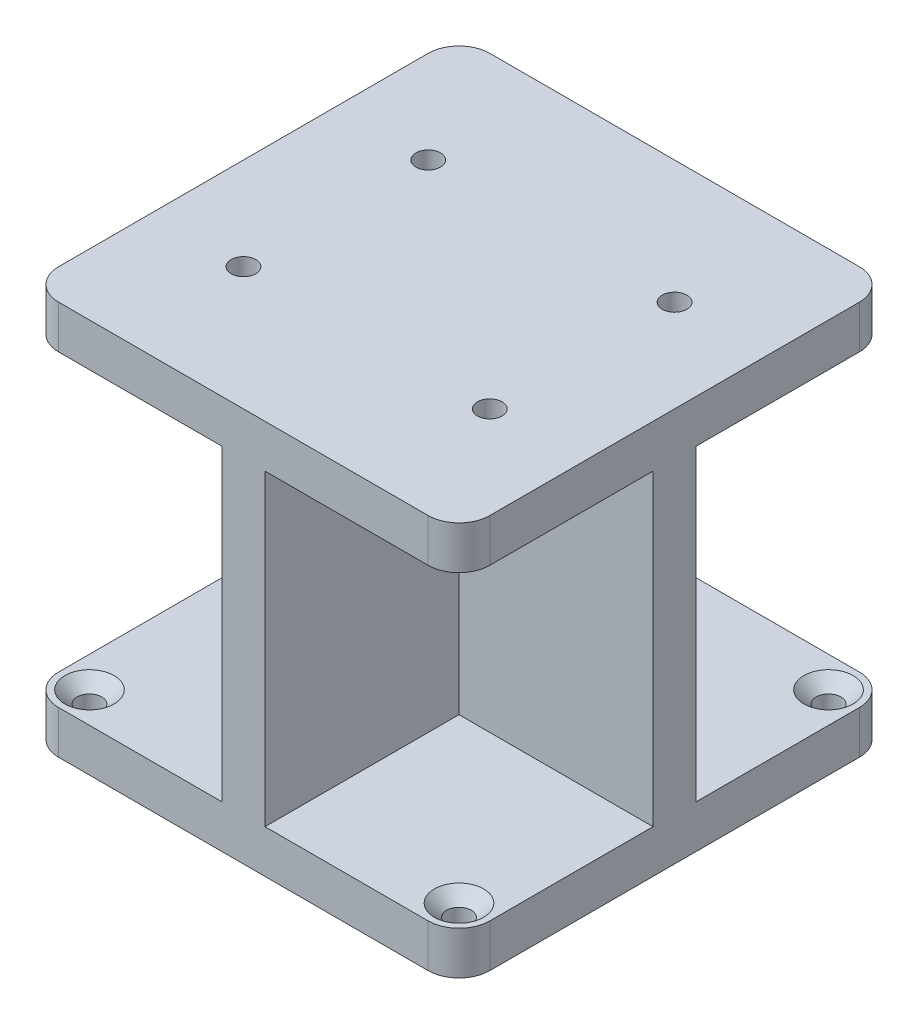
from build123d import *

# Parameters (mm, degrees)
SKETCH1_R           = 2
BOSS_EXTRUDE1_DEPTH = 3.5
BOSS_EXTRUDE2_DEPTH = 50
BOSS_EXTRUDE3_START = 7
SKETCH3_R           = 2
BOSS_EXTRUDE3_DEPTH = 7
CHAMFER1_SIZE       = 2


with BuildPart() as part:
    # Sketch1 → Boss-Extrude1 (new, symmetric)
    with BuildSketch(Plane(origin=(0, 0, 0), x_dir=(1, 0, 0), z_dir=(0, 1, 0))):
        with BuildLine():
            Line((-30, 35), (30, 35))
            ThreePointArc((30, 35), (33.535533906, 33.535533906), (35, 30))
            Line((35, 30), (35, -30))
            ThreePointArc((35, -30), (33.535533906, -33.535533906), (30, -35))
            Line((30, -35), (-30, -35))
            ThreePointArc((-30, -35), (-33.535533906, -33.535533906), (-35, -30))
            Line((-35, -30), (-35, 30))
            ThreePointArc((-35, 30), (-33.535533906, 33.535533906), (-30, 35))
        make_face()
        with Locations(Location((30, 30, 0), (0, 0, 270))):
            Circle(SKETCH1_R, mode=Mode.SUBTRACT)
        with Locations(Location((-30, 30, 0), (0, 0, 90))):
            Circle(SKETCH1_R, mode=Mode.SUBTRACT)
        with Locations(Location((30, -30, 0), (0, 0, 90))):
            Circle(SKETCH1_R, mode=Mode.SUBTRACT)
        with Locations(Location((-30, -30, 0), (0, 0, 270))):
            Circle(SKETCH1_R, mode=Mode.SUBTRACT)
    extrude(amount=BOSS_EXTRUDE1_DEPTH, both=True)

    # Sketch2 → Boss-Extrude2 (add)
    with BuildSketch(Plane(origin=(0, 3.5, 0), x_dir=(1, 0, 0), z_dir=(0, 1, 0))):
        Polygon((-3.5, 35), (3.5, 35), (3.5, 3.5), (35, 3.5), (35, -3.5), (3.5, -3.5), (3.5, -35), (-3.5, -35), (-3.5, -3.5), (-35, -3.5), (-35, 3.5), (-3.5, 3.5), align=None)
    extrude(amount=BOSS_EXTRUDE2_DEPTH)

    # Sketch3 → Boss-Extrude3 (add)
    with BuildSketch(Plane(origin=(0, 53.5, 0), x_dir=(1, 0, 0), z_dir=(0, 1, 0)).offset(BOSS_EXTRUDE3_START)):
        with BuildLine():
            Line((30, -35), (-30, -35))
            ThreePointArc((-30, -35), (-33.535533906, -33.535533906), (-35, -30))
            Line((-35, -30), (-35, 30))
            ThreePointArc((-35, 30), (-33.535533906, 33.535533906), (-30, 35))
            Line((-30, 35), (30, 35))
            ThreePointArc((30, 35), (33.535533906, 33.535533906), (35, 30))
            Line((35, 30), (35, -30))
            ThreePointArc((35, -30), (33.535533906, -33.535533906), (30, -35))
        make_face()
        with Locations(Location((20, -15, 0), (0, 0, 270))):
            Circle(SKETCH3_R, mode=Mode.SUBTRACT)
        with Locations(Location((20, 15, 0), (0, 0, 270))):
            Circle(SKETCH3_R, mode=Mode.SUBTRACT)
        with Locations(Location((-20, 15, 0), (0, 0, 90))):
            Circle(SKETCH3_R, mode=Mode.SUBTRACT)
        with Locations(Location((-20, -15, 0), (0, 0, 90))):
            Circle(SKETCH3_R, mode=Mode.SUBTRACT)
    extrude(amount=-BOSS_EXTRUDE3_DEPTH)

    # Chamfer1
    chamfer1_edges = [part.edges().sort_by_distance(p)[0] for p in [
        (30, 3.5, -32),
        (-30, 3.5, -28),
        (30, 3.5, 32),
        (-30, 3.5, 28),
    ]]
    chamfer(chamfer1_edges, length=CHAMFER1_SIZE)


solid = part.part
